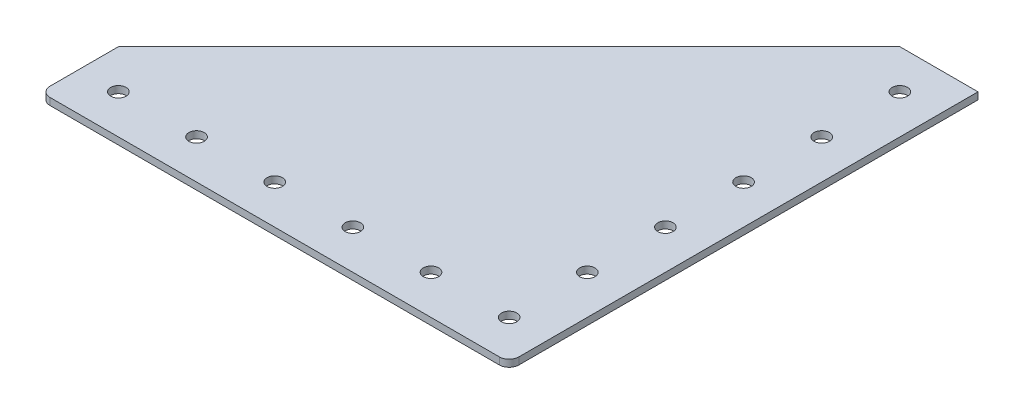
from build123d import *

# Parameters (mm, degrees)
SKETCH1_R           = 2.4892
BOSS_EXTRUDE2_DEPTH = 1.143
FILLET1_R           = 3.175


with BuildPart() as part:
    # Sketch1 → Boss-Extrude2 (new, symmetric)
    with BuildSketch(Plane(origin=(0, 0, 0), x_dir=(1, 0, 0), z_dir=(0, 1, 0))):
        Polygon((0, 0), (0, 152.4), (-25.4, 152.4), (-152.4, 25.4), (-152.4, 0), align=None)
        with Locations(Location((-12.7, 12.7, 0), (0, 0, 270))):
            Circle(SKETCH1_R, mode=Mode.SUBTRACT)
        with Locations(Location((-38.1, 12.7, 0), (0, 0, 270))):
            Circle(SKETCH1_R, mode=Mode.SUBTRACT)
        with Locations(Location((-63.5, 12.7, 0), (0, 0, 270))):
            Circle(SKETCH1_R, mode=Mode.SUBTRACT)
        with Locations(Location((-88.9, 12.7, 0), (0, 0, 270))):
            Circle(SKETCH1_R, mode=Mode.SUBTRACT)
        with Locations(Location((-114.3, 12.7, 0), (0, 0, 270))):
            Circle(SKETCH1_R, mode=Mode.SUBTRACT)
        with Locations(Location((-12.7, 38.1, 0), (0, 0, 270))):
            Circle(SKETCH1_R, mode=Mode.SUBTRACT)
        with Locations(Location((-12.7, 63.5, 0), (0, 0, 270))):
            Circle(SKETCH1_R, mode=Mode.SUBTRACT)
        with Locations(Location((-12.7, 88.9, 0), (0, 0, 270))):
            Circle(SKETCH1_R, mode=Mode.SUBTRACT)
        with Locations(Location((-12.7, 114.3, 0), (0, 0, 270))):
            Circle(SKETCH1_R, mode=Mode.SUBTRACT)
        with Locations(Location((-139.7, 12.7, 0), (0, 0, 270))):
            Circle(SKETCH1_R, mode=Mode.SUBTRACT)
        with Locations(Location((-12.7, 139.7, 0), (0, 0, 270))):
            Circle(SKETCH1_R, mode=Mode.SUBTRACT)
    extrude(amount=BOSS_EXTRUDE2_DEPTH, both=True)

    # Fillet1
    fillet1_edges = [part.edges().sort_by_distance(p)[0] for p in [
        (-152.4, 0, 0),
        (0, 0, 0),
    ]]
    fillet(fillet1_edges, radius=FILLET1_R)


solid = part.part
